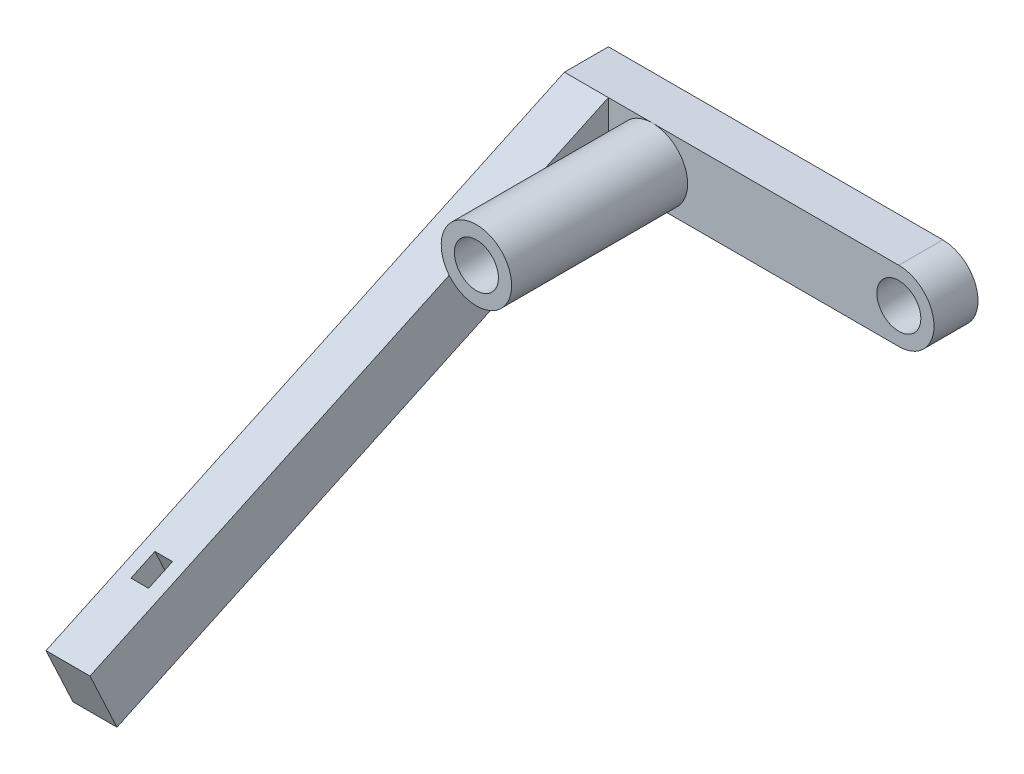
from build123d import *

# Parameters (mm, degrees)
CROQUIS1_R              = 4
CROQUIS1_R_2            = 1.5
CROQUIS1_R_3            = 3.5
CROQUIS1_R_4            = 1
SALIENTE_EXTRUIR1_DEPTH = 2
REDONDEO1_R             = 3
REDONDEO2_R             = 10
REDONDEO3_R             = 2
CROQUIS2_R              = 2.5
SALIENTE_EXTRUIR2_DEPTH = 5
CORTAR_EXTRUIR1_START   = -2
CROQUIS3_W              = 157.769698099
CROQUIS3_H              = 195.926743138
CORTAR_EXTRUIR1_DEPTH   = 2
CROQUIS9_W              = 5
CROQUIS9_H              = 8
SALIENTE_EXTRUIR8_DEPTH = 65
CORTAR_EXTRUIR2_DEPTH   = 5
CROQUIS11_W             = 2
CROQUIS11_H             = 3
CORTAR_EXTRUIR3_DEPTH   = 7.250462
CROQUIS12_R             = 4
CROQUIS12_R_2           = 2.5
SALIENTE_EXTRUIR9_DEPTH = 20


with BuildPart() as part:
    # Croquis1 → Saliente-Extruir1 (new body)
    with BuildSketch(Plane.XY):
        with BuildLine():
            Line((-42.426406871, 42.426406871), (-38.890872965, 45.961940777))
            Line((-38.890872965, 45.961940777), (-31.096194078, 38.16726189))
            Line((-31.096194078, 38.16726189), (-22.653119822, 29.724187634))
            ThreePointArc((-22.653119822, 29.724187634), (-19.456811617, 29.044722177), (-17.535923889, 31.688251973))
            Line((-17.535923889, 31.688251973), (-15, 80))
            Line((-15, 80), (0, 83))
            Line((0, 83), (15, 80))
            Line((15, 80), (17.535923889, 31.688251973))
            ThreePointArc((17.535923889, 31.688251973), (19.456811617, 29.044722177), (22.653119822, 29.724187634))
            Line((22.653119822, 29.724187634), (31.096194078, 38.16726189))
            Line((31.096194078, 38.16726189), (38.890872965, 45.961940777))
            Line((38.890872965, 45.961940777), (42.426406871, 42.426406871))
            Line((42.426406871, 42.426406871), (45.961940777, 38.890872965))
            Line((45.961940777, 38.890872965), (38.16726189, 31.096194078))
            Line((38.16726189, 31.096194078), (28.284271247, 21.213203436))
            ThreePointArc((28.284271247, 21.213203436), (19.497474683, 0), (28.284271247, -21.213203436))
            Line((28.284271247, -21.213203436), (38.16726189, -31.096194078))
            Line((38.16726189, -31.096194078), (45.961940777, -38.890872965))
            Line((45.961940777, -38.890872965), (42.426406871, -42.426406871))
            Line((42.426406871, -42.426406871), (38.890872965, -45.961940777))
            Line((38.890872965, -45.961940777), (31.096194078, -38.16726189))
            Line((31.096194078, -38.16726189), (22.653119822, -29.724187634))
            ThreePointArc((22.653119822, -29.724187634), (19.456811617, -29.044722177), (17.535923889, -31.688251973))
            Line((17.535923889, -31.688251973), (15, -80))
            Line((15, -80), (0, -83))
            Line((0, -83), (-15, -80))
            Line((-15, -80), (-17.535923889, -31.688251973))
            ThreePointArc((-17.535923889, -31.688251973), (-19.456811617, -29.044722177), (-22.653119822, -29.724187634))
            Line((-22.653119822, -29.724187634), (-31.096194078, -38.16726189))
            Line((-31.096194078, -38.16726189), (-38.890872965, -45.961940777))
            Line((-38.890872965, -45.961940777), (-42.426406871, -42.426406871))
            Line((-42.426406871, -42.426406871), (-45.961940777, -38.890872965))
            Line((-45.961940777, -38.890872965), (-38.16726189, -31.096194078))
            Line((-38.16726189, -31.096194078), (-28.284271247, -21.213203436))
            ThreePointArc((-28.284271247, -21.213203436), (-19.497474683, 0), (-28.284271247, 21.213203436))
            Line((-28.284271247, 21.213203436), (-38.16726189, 31.096194078))
            Line((-38.16726189, 31.096194078), (-45.961940777, 38.890872965))
            Line((-45.961940777, 38.890872965), (-42.426406871, 42.426406871))
        make_face()
        with Locations((-15.25, 15.25)):
            Circle(CROQUIS1_R, mode=Mode.SUBTRACT)
        with Locations((-24.04163056, 24.04163056)):
            Circle(CROQUIS1_R_2, mode=Mode.SUBTRACT)
        with Locations((-38.890872965, 38.890872965)):
            Circle(CROQUIS1_R_2, mode=Mode.SUBTRACT)
        with Locations(Location((38.890872965, 38.890872965, 0), (0, 0, 180))):
            Circle(CROQUIS1_R_2, mode=Mode.SUBTRACT)
        with Locations(Location((24.04163056, 24.04163056, 0), (0, 0, 180))):
            Circle(CROQUIS1_R_2, mode=Mode.SUBTRACT)
        with Locations(Location((15.25, 15.25, 0), (0, 0, 180))):
            Circle(CROQUIS1_R, mode=Mode.SUBTRACT)
        with Locations((15.25, -15.25)):
            Circle(CROQUIS1_R, mode=Mode.SUBTRACT)
        with Locations((24.04163056, -24.04163056)):
            Circle(CROQUIS1_R_2, mode=Mode.SUBTRACT)
        with Locations((38.890872965, -38.890872965)):
            Circle(CROQUIS1_R_2, mode=Mode.SUBTRACT)
        with Locations(Location((-15.25, -15.25, 0), (0, 0, 180))):
            Circle(CROQUIS1_R, mode=Mode.SUBTRACT)
        with Locations(Location((-24.04163056, -24.04163056, 0), (0, 0, 180))):
            Circle(CROQUIS1_R_2, mode=Mode.SUBTRACT)
        with Locations(Location((-38.890872965, -38.890872965, 0), (0, 0, 180))):
            Circle(CROQUIS1_R_2, mode=Mode.SUBTRACT)
        Circle(CROQUIS1_R_3, mode=Mode.SUBTRACT)
        with Locations((-11.5, -75)):
            Circle(CROQUIS1_R_2, mode=Mode.SUBTRACT)
        with Locations(Location((-14, 30, 0), (0, 0, 180))):
            Circle(CROQUIS1_R_2, mode=Mode.SUBTRACT)
        with Locations(Location((11.5, -75, 0), (0, 0, 180))):
            Circle(CROQUIS1_R_2, mode=Mode.SUBTRACT)
        with Locations((11.5, 75)):
            Circle(CROQUIS1_R_2, mode=Mode.SUBTRACT)
        with Locations(Location((-11.5, 75, 0), (0, 0, 180))):
            Circle(CROQUIS1_R_2, mode=Mode.SUBTRACT)
        with Locations((14, 30)):
            Circle(CROQUIS1_R_2, mode=Mode.SUBTRACT)
        with Locations(Location((14, -30, 0), (0, 0, 180))):
            Circle(CROQUIS1_R_2, mode=Mode.SUBTRACT)
        with Locations((-14, -30)):
            Circle(CROQUIS1_R_2, mode=Mode.SUBTRACT)
        with Locations((0, 76)):
            Circle(CROQUIS1_R_4, mode=Mode.SUBTRACT)
        with Locations(Location((0, -76, 0), (0, 0, 180))):
            Circle(CROQUIS1_R_4, mode=Mode.SUBTRACT)
        with BuildLine():
            Line((-0.620989881, -15.781703725), (-8.212878231, -22.282027547))
            ThreePointArc((-8.212878231, -22.282027547), (-8.50046857, -23.388327104), (-7.562491222, -24.04163056))
            Line((-7.562491222, -24.04163056), (8.360661842, -24.04163056))
            ThreePointArc((8.360661842, -24.04163056), (9.30628687, -23.36688939), (8.975807622, -22.253217173))
            Line((8.975807622, -22.253217173), (0.644542909, -15.75289335))
            ThreePointArc((0.644542909, -15.75289335), (0.006637615, -15.541565769), (-0.620989881, -15.781703725))
        make_face(mode=Mode.SUBTRACT)
        with BuildLine():
            Line((-7.562491222, 24.04163056), (8.360661842, 24.04163056))
            ThreePointArc((8.360661842, 24.04163056), (9.30628687, 23.36688939), (8.975807622, 22.253217173))
            Line((8.975807622, 22.253217173), (0.644542909, 15.75289335))
            ThreePointArc((0.644542909, 15.75289335), (0.006637615, 15.541565769), (-0.620989881, 15.781703725))
            Line((-0.620989881, 15.781703725), (-8.212878231, 22.282027547))
            ThreePointArc((-8.212878231, 22.282027547), (-8.50046857, 23.388327104), (-7.562491222, 24.04163056))
        make_face(mode=Mode.SUBTRACT)
        Polygon((-10, -70), (10, -70), (0, -54.625), align=None, mode=Mode.SUBTRACT)
        Polygon((0, -48.625), (-10, -33.25), (10, -33.25), align=None, mode=Mode.SUBTRACT)
        Polygon((-13.235898342, -37.299112885), (-11.768175631, -65.260618389), (-3.788893912, -51.823882197), align=None, mode=Mode.SUBTRACT)
        Polygon((3.788893912, -51.823882197), (11.768175631, -65.260618389), (13.235898342, -37.299112885), align=None, mode=Mode.SUBTRACT)
        Polygon((13.235898342, 37.299112885), (11.768175631, 65.260618389), (3.788893912, 51.823882197), align=None, mode=Mode.SUBTRACT)
        Polygon((-3.788893912, 51.823882197), (-11.768175631, 65.260618389), (-13.235898342, 37.299112885), align=None, mode=Mode.SUBTRACT)
        Polygon((-10, 33.25), (10, 33.25), (0, 48.625), align=None, mode=Mode.SUBTRACT)
        Polygon((0, 54.625), (-10, 70), (10, 70), align=None, mode=Mode.SUBTRACT)
    extrude(amount=SALIENTE_EXTRUIR1_DEPTH)

    # Redondeo1
    redondeo1_edges = [part.edges().sort_by_distance(p)[0] for p in [
        (-38.890872965, 45.961940777, 1),
        (-15, 80, 1),
        (15, 80, 1),
        (38.890872965, 45.961940777, 1),
        (45.961940777, 38.890872965, 1),
        (45.961940777, -38.890872965, 1),
        (38.890872965, -45.961940777, 1),
        (15, -80, 1),
        (-15, -80, 1),
        (-38.890872965, -45.961940777, 1),
        (-45.961940777, -38.890872965, 1),
        (-45.961940777, 38.890872965, 1),
    ]]
    fillet(redondeo1_edges, radius=REDONDEO1_R)

    # Redondeo2
    redondeo2_edges = [part.edges().sort_by_distance(p)[0] for p in [
        (0, 83, 1),
        (0, -83, 1),
    ]]
    fillet(redondeo2_edges, radius=REDONDEO2_R)

    # Redondeo3
    redondeo3_edges = [part.edges().sort_by_distance(p)[0] for p in [
        (0, -54.625, 1),
        (-10, -70, 1),
        (10, -70, 1),
        (0, -48.625, 1),
        (10, -33.25, 1),
        (-10, -33.25, 1),
        (-3.788893912, -51.823882197, 1),
        (-13.235898342, -37.299112885, 1),
        (-11.768175631, -65.260618389, 1),
        (13.235898342, -37.299112885, 1),
        (3.788893912, -51.823882197, 1),
        (11.768175631, -65.260618389, 1),
        (3.788893912, 51.823882197, 1),
        (13.235898342, 37.299112885, 1),
        (11.768175631, 65.260618389, 1),
        (-13.235898342, 37.299112885, 1),
        (-3.788893912, 51.823882197, 1),
        (-11.768175631, 65.260618389, 1),
        (0, 48.625, 1),
        (-10, 33.25, 1),
        (10, 33.25, 1),
        (0, 54.625, 1),
        (10, 70, 1),
        (-10, 70, 1),
    ]]
    fillet(redondeo3_edges, radius=REDONDEO3_R)

    # Croquis2 → Saliente-Extruir2 (add)
    with BuildSketch(Plane.XY.offset(2)):
        with BuildLine():
            Line((14, 34), (-14, 34))
            Line((-14, 34), (-24, 34))
            Line((-24, 34), (-24, 26))
            Line((-24, 26), (-14, 26))
            Line((-14, 26), (14, 26))
            ThreePointArc((14, 26), (18, 30), (14, 34))
        make_face()
        with Locations((-14, 30)):
            Circle(CROQUIS2_R, mode=Mode.SUBTRACT)
        with Locations(Location((14, 30, 0), (0, 0, 180))):
            Circle(CROQUIS2_R, mode=Mode.SUBTRACT)
    extrude(amount=SALIENTE_EXTRUIR2_DEPTH)

    # Croquis3 → Cortar-Extruir1 (cut)
    with BuildSketch(Plane.XY.offset(2).offset(CORTAR_EXTRUIR1_START)):
        with Locations((-2.348052334, 2.181833492)):
            Rectangle(CROQUIS3_W, CROQUIS3_H)
    extrude(amount=CORTAR_EXTRUIR1_DEPTH, mode=Mode.SUBTRACT)

    # Croquis9 → Saliente-Extruir8 (add, along a direction that is not the sketch's normal)
    with BuildSketch(Plane.XY.offset(7)):
        with Locations((-21.5, 30)):
            Rectangle(CROQUIS9_W, CROQUIS9_H)
    extrude(amount=SALIENTE_EXTRUIR8_DEPTH, dir=(0, -0.4226182617406976, 0.9063077870366508))

    # Croquis10 → Cortar-Extruir2 (cut)
    with BuildSketch(Plane.ZY.offset(24)):
        Polygon((65.910006157, 6.529812987), (62.845828385, -0.041337452), (65.910006157, -1.470187013), align=None)
    extrude(amount=-CORTAR_EXTRUIR2_DEPTH, mode=Mode.SUBTRACT)

    # Croquis11 → Cortar-Extruir3 (cut)
    with BuildSketch(Plane(origin=(0, 24.037394477, 11.208821127), x_dir=(1, 0, 0), z_dir=(0, -0.9063077870366509, -0.4226182617406975))):
        with Locations((-21.5, 46.47513361)):
            Rectangle(CROQUIS11_W, CROQUIS11_H)
    extrude(amount=-CORTAR_EXTRUIR3_DEPTH, mode=Mode.SUBTRACT)

    # Croquis12 → Saliente-Extruir9 (add)
    with BuildSketch(Plane.XY.offset(7)):
        with Locations(Location((-14, 30, 0), (0, 0, 270))):
            Circle(CROQUIS12_R)
        with Locations((-14, 30)):
            Circle(CROQUIS12_R_2, mode=Mode.SUBTRACT)
    extrude(amount=SALIENTE_EXTRUIR9_DEPTH)


solid = part.part
